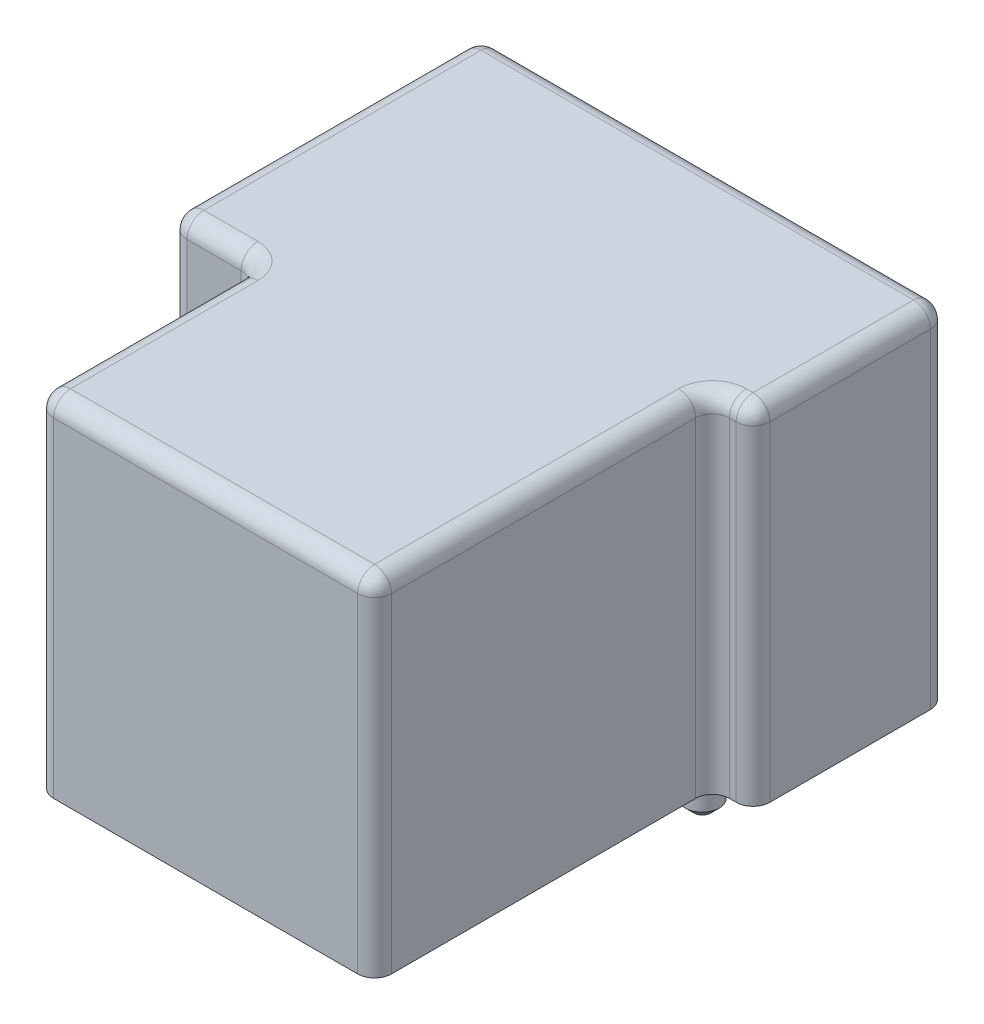
from build123d import *

# Parameters (mm, degrees)
BOSS_EXTRUDE1_DEPTH = 20.5
FILLET1_R           = 1
SKETCH2_R           = 0.5
SKETCH2_R_2         = 1
BOSS_EXTRUDE2_DEPTH = 3.2
CHAMFER1_SIZE       = 0.5


with BuildPart() as part:
    # Sketch1 → Boss-Extrude1 (new body)
    with BuildSketch(Plane(origin=(0, 0, 0), x_dir=(1, 0, 0), z_dir=(0, 1, 0))):
        with BuildLine():
            Line((0, 1), (0, 12.1))
            ThreePointArc((0, 12.1), (-0.292893219, 12.807106781), (-1, 13.1))
            Line((-1, 13.1), (-4.2, 13.1))
            ThreePointArc((-4.2, 13.1), (-4.907106781, 13.392893219), (-5.2, 14.1))
            Line((-5.2, 14.1), (-5.2, 30.5))
            ThreePointArc((-5.2, 30.5), (-4.907106781, 31.207106781), (-4.2, 31.5))
            Line((-4.2, 31.5), (21.4, 31.5))
            ThreePointArc((21.4, 31.5), (22.107106781, 31.207106781), (22.4, 30.5))
            Line((22.4, 30.5), (22.4, 21))
            ThreePointArc((22.4, 21), (22.107106781, 20.292893219), (21.4, 20))
            Line((21.4, 20), (21, 20))
            ThreePointArc((21, 20), (20.292893219, 19.707106781), (20, 19))
            Line((20, 19), (20, 1))
            ThreePointArc((20, 1), (19.707106781, 0.292893219), (19, 0))
            Line((19, 0), (1, 0))
            ThreePointArc((1, 0), (0.292893219, 0.292893219), (0, 1))
        make_face()
    extrude(amount=BOSS_EXTRUDE1_DEPTH)

    # Fillet1
    fillet1_edges = [part.edges().sort_by_distance(p)[0] for p in [
        (-4.907106781, 20.5, -31.207106781),
        (-5.2, 20.5, -22.3),
        (-4.907106781, 20.5, -13.392893219),
        (-2.6, 20.5, -13.1),
        (-0.292893219, 20.5, -12.807106781),
        (0, 20.5, -6.55),
        (0.292893219, 20.5, -0.292893219),
        (10, 20.5, 0),
        (19.707106781, 20.5, -0.292893219),
        (20, 20.5, -10),
        (22.107106781, 20.5, -31.207106781),
        (20.292893219, 20.5, -19.707106781),
        (21.2, 20.5, -20),
        (22.107106781, 20.5, -20.292893219),
        (22.4, 20.5, -25.75),
        (8.6, 20.5, -31.5),
    ]]
    fillet(fillet1_edges, radius=FILLET1_R)

    # Sketch2 → Boss-Extrude2 (add)
    with BuildSketch(Plane.XZ):
        with Locations(Location((13.7, -6.5, 0), (0, 0, 270))):
            Circle(SKETCH2_R)
        with Locations(Location((3.5, -6.5, 0), (0, 0, 270))):
            Circle(SKETCH2_R)
        with Locations(Location((17.5, -21.9, 0), (0, 0, 270))):
            Circle(SKETCH2_R_2)
        with Locations(Location((17.5, -29.6, 0), (0, 0, 270))):
            Circle(SKETCH2_R_2)
        with Locations(Location((-0.3, -19.36, 0), (0, 0, 270))):
            Circle(SKETCH2_R_2)
    extrude(amount=BOSS_EXTRUDE2_DEPTH)

    # Chamfer1
    chamfer1_edges = [part.edges().sort_by_distance(p)[0] for p in [
        (-0.3, -3.2, -18.36),
        (13.7, -3.2, -6),
        (3.5, -3.2, -6),
        (17.5, -3.2, -20.9),
        (17.5, -3.2, -28.6),
    ]]
    chamfer(chamfer1_edges, length=CHAMFER1_SIZE)


solid = part.part
